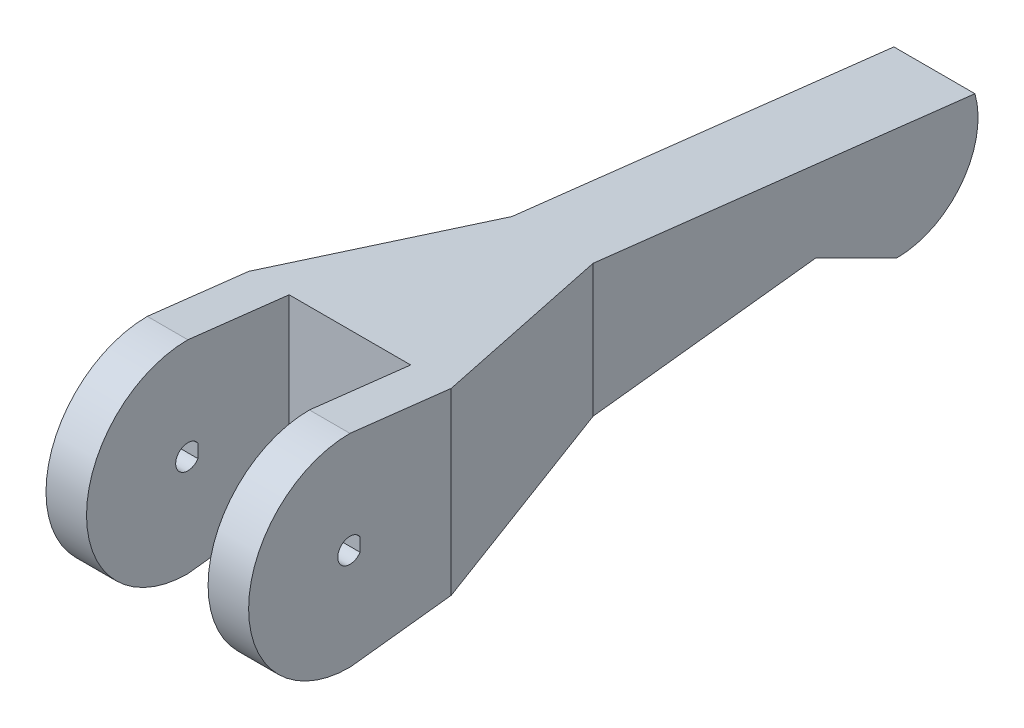
from build123d import *

# Parameters (mm, degrees)
BOSS_EXTRUDE1_DEPTH     = 50
CUT_EXTRUDE1_DEPTH      = 179.955301682
CUT_EXTRUDE1_DEPTH_BACK = 179.955301682
CUT_EXTRUDE5_DEPTH      = 179.955301682
CUT_EXTRUDE5_DEPTH_BACK = 179.955301682
SKETCH5_W               = 30
SKETCH5_H               = 50
CUT_EXTRUDE6_DEPTH      = 176.356779168
CUT_EXTRUDE6_DEPTH_BACK = 176.356779168
CUT_EXTRUDE7_DEPTH      = 179.955301682
CUT_EXTRUDE7_DEPTH_BACK = 179.955301682


with BuildPart() as part:
    # Sketch1 → Boss-Extrude1 (new body)
    with BuildSketch(Plane(origin=(0, 0, 0), x_dir=(0, 0, -1), z_dir=(1, 0, 0))):
        with BuildLine():
            Line((0, 25), (130, 10))
            Line((130, 10), (150, 20))
            ThreePointArc((150, 20), (170, 0), (150, -20))
            Line((150, -20), (130, -10))
            Line((130, -10), (0, -25))
            ThreePointArc((0, -25), (-25, 0), (0, 25))
        make_face()
    extrude(amount=BOSS_EXTRUDE1_DEPTH)

    # Sketch3 → Cut-Extrude1 (cut, two sides: drawn at the far end of the back side and taken through both)
    with BuildSketch(Plane(origin=(0, 0, 0), x_dir=(1, 0, 0), z_dir=(0, 1, 0)).offset(-CUT_EXTRUDE1_DEPTH_BACK)):
        Polygon((15, 170), (15, 75), (0, 25), (-45.149252574, 25), (-45.149252574, 231.988814071), (97.66148476, 231.988814071), (97.66148476, 25), (50, 25), (35, 75), (35, 170), align=None)
    extrude(amount=CUT_EXTRUDE1_DEPTH + CUT_EXTRUDE1_DEPTH_BACK, mode=Mode.SUBTRACT)

    # Sketch5 → Cut-Extrude5 (cut, two sides: drawn at the far end of the back side and taken through both)
    with BuildSketch(Plane(origin=(0, 0, 0), x_dir=(1, 0, 0), z_dir=(0, 1, 0)).offset(-CUT_EXTRUDE5_DEPTH_BACK)):
        with Locations((25, 0)):
            Rectangle(SKETCH5_W, SKETCH5_H)
    extrude(amount=CUT_EXTRUDE5_DEPTH + CUT_EXTRUDE5_DEPTH_BACK, mode=Mode.SUBTRACT)

    # Sketch6 → Cut-Extrude6 (cut, two sides: drawn at the far end of the back side and taken through both)
    with BuildSketch(Plane.ZY.offset(-15).offset(-CUT_EXTRUDE6_DEPTH_BACK)):
        Polygon((-130, 10), (-189.136006784, 3.176614602), (-191.554152375, 31.687839347), (-130.171893451, 25.24666108), align=None)
    extrude(amount=CUT_EXTRUDE6_DEPTH + CUT_EXTRUDE6_DEPTH_BACK, mode=Mode.SUBTRACT)

    # Sketch7 → Cut-Extrude7 (cut, two sides: drawn at the far end of the back side and taken through both)
    with BuildSketch(Plane.ZY.offset(-CUT_EXTRUDE7_DEPTH_BACK)):
        with BuildLine():
            Line((-2.5, 1.658312395), (-2.5, -1.658312395))
            ThreePointArc((-2.5, -1.658312395), (3, 0), (-2.5, 1.658312395))
        make_face()
    extrude(amount=CUT_EXTRUDE7_DEPTH + CUT_EXTRUDE7_DEPTH_BACK, mode=Mode.SUBTRACT)


solid = part.part
